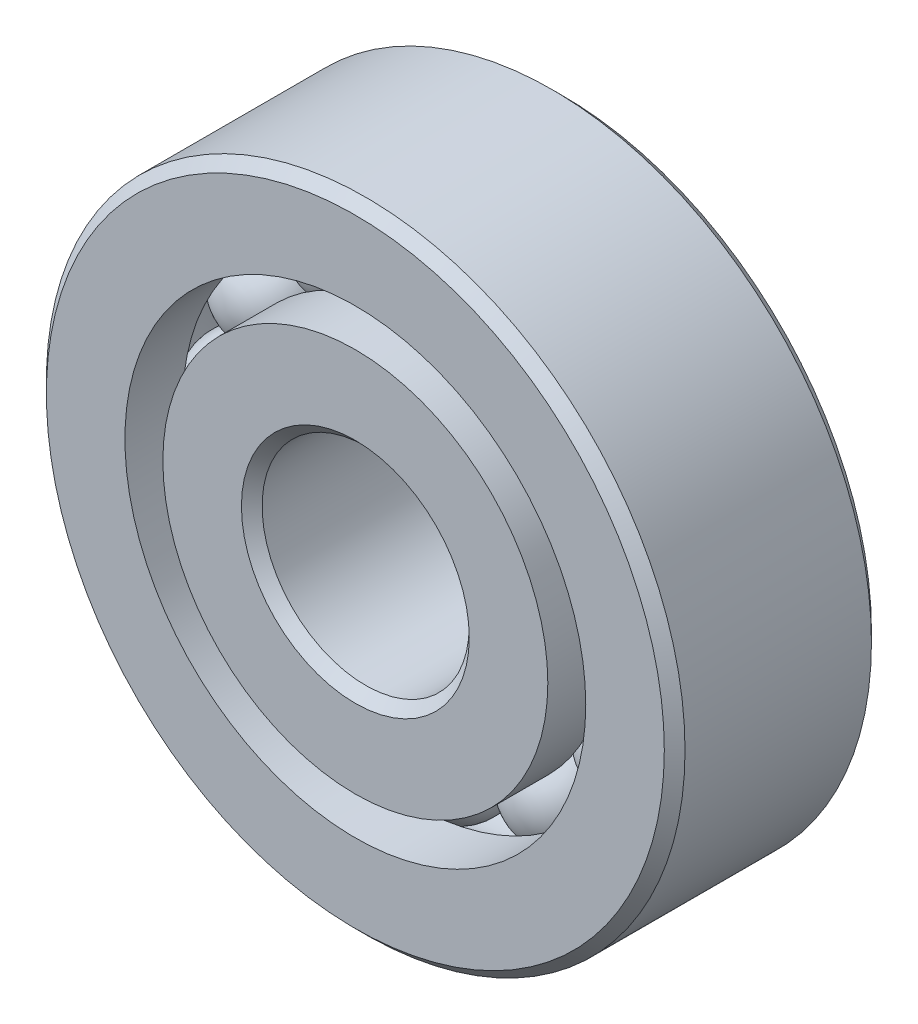
from build123d import *

# Parameters (mm, degrees)
CIRPATTERN1_COUNT = 12


with BuildPart() as part:
    # Sketch1 → Revolve1 (revolve)
    with BuildSketch(Plane(origin=(0, 0, 0), x_dir=(0, 0, -1), z_dir=(1, 0, 0))):
        with BuildLine():
            Line((5.4, 18.5), (-5.4, 18.5))
            Line((-5.4, 18.5), (-6, 17.9))
            Line((-6, 17.9), (-6, 13.348901099))
            Line((-6, 13.348901099), (-2.666666667, 13.348901099))
            ThreePointArc((-2.666666667, 13.348901099), (0, 15.134214752), (2.666666667, 13.348901099))
            Line((2.666666667, 13.348901099), (6, 13.348901099))
            Line((6, 13.348901099), (6, 17.9))
            Line((6, 17.9), (5.4, 18.5))
        make_face()
    revolve(axis=Axis((0, 0, 6), (0, 0, -1)))


with BuildPart() as body_2:
    # Sketch3 → Revolve3 (revolve)
    with BuildSketch(Plane(origin=(0, 0, 0), x_dir=(0, 0, -1), z_dir=(1, 0, 0))):
        with BuildLine():
            Line((-6, 11.151098901), (-2.666666667, 11.151098901))
            ThreePointArc((-2.666666667, 11.151098901), (0, 9.365785248), (2.666666667, 11.151098901))
            Line((2.666666667, 11.151098901), (6, 11.151098901))
            Line((6, 11.151098901), (6, 6.6))
            Line((6, 6.6), (5.4, 6))
            Line((5.4, 6), (-5.4, 6))
            Line((-5.4, 6), (-6, 6.6))
            Line((-6, 6.6), (-6, 11.151098901))
        make_face()
    revolve(axis=Axis((0, 0, 6), (0, 0, -1)))


with BuildPart() as body_3:
    # Sketch4 → Revolve4 (revolve)
    with BuildSketch(Plane(origin=(0, 0, 0), x_dir=(0, 0, -1), z_dir=(1, 0, 0))):
        with BuildLine():
            Line((-2.884214752, 12.25), (2.884214752, 12.25))
            ThreePointArc((2.884214752, 12.25), (0, 15.134214752), (-2.884214752, 12.25))
        make_face()
    revolve(axis=Axis((0, 12.25, 2.884214752), (0, 0, -1)))


with BuildPart() as cirpattern1_1:
    # CirPattern1: pattern copy
    add(body_3.part.rotate(Axis((0, 0, -6), (0, 0, 1)), 1 * 360 / CIRPATTERN1_COUNT))


with BuildPart() as cirpattern1_2:
    # CirPattern1: pattern copy
    add(body_3.part.rotate(Axis((0, 0, -6), (0, 0, 1)), 2 * 360 / CIRPATTERN1_COUNT))


with BuildPart() as cirpattern1_3:
    # CirPattern1: pattern copy
    add(body_3.part.rotate(Axis((0, 0, -6), (0, 0, 1)), 3 * 360 / CIRPATTERN1_COUNT))


with BuildPart() as cirpattern1_4:
    # CirPattern1: pattern copy
    add(body_3.part.rotate(Axis((0, 0, -6), (0, 0, 1)), 4 * 360 / CIRPATTERN1_COUNT))


with BuildPart() as cirpattern1_5:
    # CirPattern1: pattern copy
    add(body_3.part.rotate(Axis((0, 0, -6), (0, 0, 1)), 5 * 360 / CIRPATTERN1_COUNT))


with BuildPart() as cirpattern1_6:
    # CirPattern1: pattern copy
    add(body_3.part.rotate(Axis((0, 0, -6), (0, 0, 1)), 6 * 360 / CIRPATTERN1_COUNT))


with BuildPart() as cirpattern1_7:
    # CirPattern1: pattern copy
    add(body_3.part.rotate(Axis((0, 0, -6), (0, 0, 1)), 7 * 360 / CIRPATTERN1_COUNT))


with BuildPart() as cirpattern1_8:
    # CirPattern1: pattern copy
    add(body_3.part.rotate(Axis((0, 0, -6), (0, 0, 1)), 8 * 360 / CIRPATTERN1_COUNT))


with BuildPart() as cirpattern1_9:
    # CirPattern1: pattern copy
    add(body_3.part.rotate(Axis((0, 0, -6), (0, 0, 1)), 9 * 360 / CIRPATTERN1_COUNT))


with BuildPart() as cirpattern1_10:
    # CirPattern1: pattern copy
    add(body_3.part.rotate(Axis((0, 0, -6), (0, 0, 1)), 10 * 360 / CIRPATTERN1_COUNT))


with BuildPart() as cirpattern1_11:
    # CirPattern1: pattern copy
    add(body_3.part.rotate(Axis((0, 0, -6), (0, 0, 1)), 11 * 360 / CIRPATTERN1_COUNT))


solid = Compound([part.part, body_2.part, body_3.part, cirpattern1_1.part, cirpattern1_2.part, cirpattern1_3.part, cirpattern1_4.part, cirpattern1_5.part, cirpattern1_6.part, cirpattern1_7.part, cirpattern1_8.part, cirpattern1_9.part, cirpattern1_10.part, cirpattern1_11.part])
